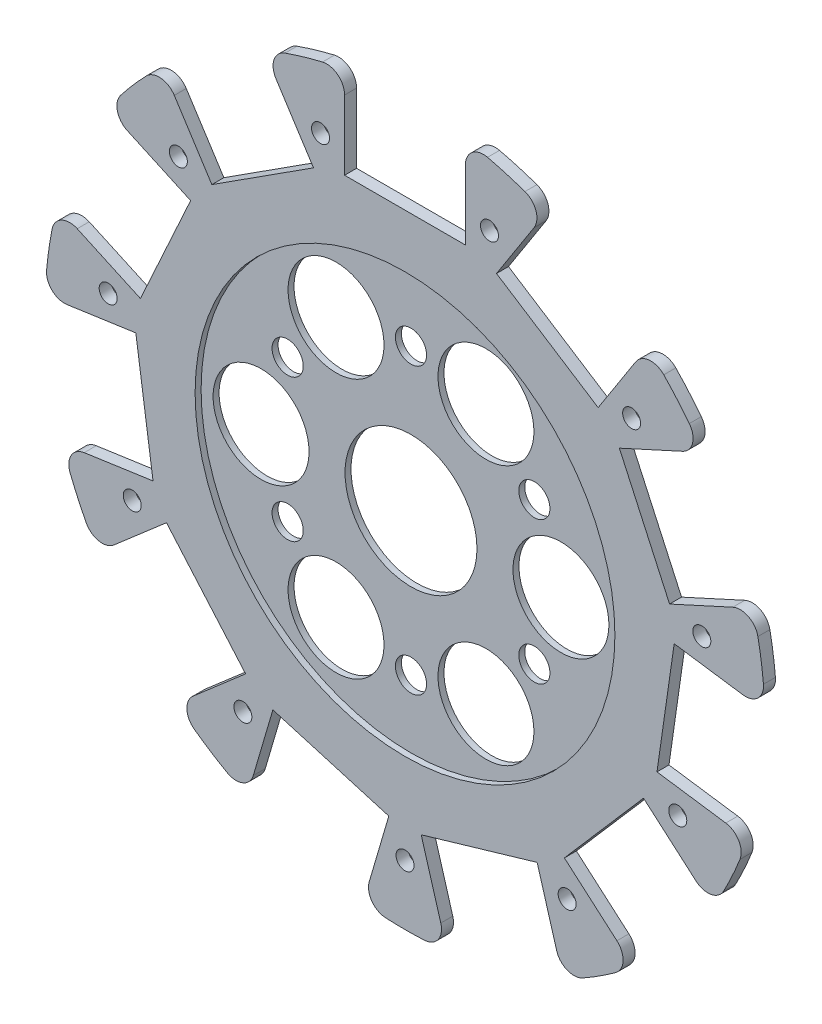
from build123d import *

# Parameters (mm, degrees)
BOSS_EXTRUDE1_DEPTH = 2
SKETCH2_R           = 35
CUT_EXTRUDE1_DEPTH  = 1
SKETCH3_R           = 11
SKETCH3_R_2         = 2.6
SKETCH3_R_3         = 8
CUT_EXTRUDE2_DEPTH  = 1
SKETCH4_R           = 1.5
CUT_EXTRUDE3_DEPTH  = 2


with BuildPart() as part:
    # Sketch1 → Boss-Extrude1 (new body)
    with BuildSketch(Plane.XY):
        with BuildLine():
            Line((21.520746486, 52.119258472), (15.256667967, 42.372162038))
            Line((15.256667967, 42.372162038), (32.20522538, 31.479985569))
            Line((32.20522538, 31.479985569), (38.4693039, 41.227082003))
            ThreePointArc((38.4693039, 41.227082003), (40.698070229, 42.590620718), (43.150594208, 41.689641633))
            ThreePointArc((43.150594208, 41.689641633), (45.344974461, 39.291644037), (47.406271028, 36.778328771))
            ThreePointArc((47.406271028, 36.778328771), (47.949048893, 34.222545257), (46.282202516, 32.210516346))
            Line((46.282202516, 32.210516346), (35.742846148, 27.397353567))
            Line((35.742846148, 27.397353567), (44.112124759, 9.071189697))
            Line((44.112124759, 9.071189697), (54.651481127, 13.884352476))
            ThreePointArc((54.651481127, 13.884352476), (57.263623361, 13.826472187), (58.839711753, 11.742585779))
            ThreePointArc((58.839711753, 11.742585779), (59.389286513, 8.538890296), (59.764558712, 5.310133889))
            ThreePointArc((59.764558712, 5.310133889), (58.83941162, 2.86662411), (56.349386262, 2.075162869))
            Line((56.349386262, 2.075162869), (44.880923224, 3.724078919))
            Line((44.880923224, 3.724078919), (42.013736207, -16.217644809))
            Line((42.013736207, -16.217644809), (53.482199245, -17.86656086))
            ThreePointArc((53.482199245, -17.86656086), (55.648380681, -19.32748357), (55.847636558, -21.93265809))
            ThreePointArc((55.847636558, -21.93265809), (54.577919721, -24.92490078), (53.148021281, -27.843990983))
            ThreePointArc((53.148021281, -27.843990983), (51.048676897, -29.399429937), (48.526038015, -28.719040157))
            Line((48.526038015, -28.719040157), (39.76962429, -21.131564473))
            Line((39.76962429, -21.131564473), (26.576283265, -36.357491677))
            Line((26.576283265, -36.357491677), (35.33269699, -43.944967362))
            ThreePointArc((35.33269699, -43.944967362), (36.365170327, -46.345099856), (35.124331356, -48.644437984))
            ThreePointArc((35.124331356, -48.644437984), (32.438449047, -50.47521197), (29.657362619, -52.157845455))
            ThreePointArc((29.657362619, -52.157845455), (27.050347952, -52.331372705), (25.296015568, -50.395150852))
            Line((25.296015568, -50.395150852), (22.031750643, -39.278085453))
            Line((22.031750643, -39.278085453), (2.701048165, -44.954091828))
            Line((2.701048165, -44.954091828), (5.96531309, -56.071157227))
            ThreePointArc((5.96531309, -56.071157227), (5.536275339, -58.648474396), (3.249299125, -59.911952524))
            ThreePointArc((3.249299125, -59.911952524), (0, -60), (-3.249299125, -59.911952524))
            ThreePointArc((-3.249299125, -59.911952524), (-5.536275339, -58.648474396), (-5.96531309, -56.071157227))
            Line((-5.96531309, -56.071157227), (-2.701048165, -44.954091828))
            Line((-2.701048165, -44.954091828), (-22.031750643, -39.278085453))
            Line((-22.031750643, -39.278085453), (-25.296015568, -50.395150852))
            ThreePointArc((-25.296015568, -50.395150852), (-27.050347952, -52.331372705), (-29.657362619, -52.157845455))
            ThreePointArc((-29.657362619, -52.157845455), (-32.438449047, -50.47521197), (-35.124331356, -48.644437984))
            ThreePointArc((-35.124331356, -48.644437984), (-36.365170327, -46.345099856), (-35.33269699, -43.944967362))
            Line((-35.33269699, -43.944967362), (-26.576283265, -36.357491677))
            Line((-26.576283265, -36.357491677), (-39.76962429, -21.131564473))
            Line((-39.76962429, -21.131564473), (-48.526038015, -28.719040157))
            ThreePointArc((-48.526038015, -28.719040157), (-51.048676897, -29.399429937), (-53.148021281, -27.843990983))
            ThreePointArc((-53.148021281, -27.843990983), (-54.577919721, -24.92490078), (-55.847636558, -21.93265809))
            ThreePointArc((-55.847636558, -21.93265809), (-55.648380681, -19.32748357), (-53.482199245, -17.86656086))
            Line((-53.482199245, -17.86656086), (-42.013736207, -16.217644809))
            Line((-42.013736207, -16.217644809), (-44.880923224, 3.724078919))
            Line((-44.880923224, 3.724078919), (-56.349386262, 2.075162869))
            ThreePointArc((-56.349386262, 2.075162869), (-58.83941162, 2.86662411), (-59.764558712, 5.310133889))
            ThreePointArc((-59.764558712, 5.310133889), (-59.389286513, 8.538890296), (-58.839711753, 11.742585779))
            ThreePointArc((-58.839711753, 11.742585779), (-57.263623361, 13.826472187), (-54.651481127, 13.884352476))
            Line((-54.651481127, 13.884352476), (-44.112124759, 9.071189697))
            Line((-44.112124759, 9.071189697), (-35.742846148, 27.397353567))
            Line((-35.742846148, 27.397353567), (-46.282202516, 32.210516346))
            ThreePointArc((-46.282202516, 32.210516346), (-47.949048893, 34.222545257), (-47.406271028, 36.778328771))
            ThreePointArc((-47.406271028, 36.778328771), (-45.344974461, 39.291644037), (-43.150594208, 41.689641633))
            ThreePointArc((-43.150594208, 41.689641633), (-40.698070229, 42.590620718), (-38.4693039, 41.227082003))
            Line((-38.4693039, 41.227082003), (-32.20522538, 31.479985569))
            Line((-32.20522538, 31.479985569), (-15.256667967, 42.372162038))
            Line((-15.256667967, 42.372162038), (-21.520746486, 52.119258472))
            ThreePointArc((-21.520746486, 52.119258472), (-21.835201934, 54.713050089), (-19.99682725, 56.569664131))
            ThreePointArc((-19.99682725, 56.569664131), (-16.90395341, 57.569578417), (-13.76146789, 58.400530832))
            ThreePointArc((-13.76146789, 58.400530832), (-11.211167359, 57.832548102), (-10.073394495, 55.480504291))
            Line((-10.073394495, 55.480504291), (-10.073394495, 43.894108449))
            Line((-10.073394495, 43.894108449), (10.073394495, 43.894108449))
            Line((10.073394495, 43.894108449), (10.073394495, 55.480504291))
            ThreePointArc((10.073394495, 55.480504291), (11.211167359, 57.832548102), (13.76146789, 58.400530832))
            ThreePointArc((13.76146789, 58.400530832), (16.90395341, 57.569578417), (19.99682725, 56.569664131))
            ThreePointArc((19.99682725, 56.569664131), (21.835201934, 54.713050089), (21.520746486, 52.119258472))
        make_face()
    extrude(amount=BOSS_EXTRUDE1_DEPTH)

    # Sketch2 → Cut-Extrude1 (cut)
    with BuildSketch(Plane.XY.offset(2)):
        Circle(SKETCH2_R)
    extrude(amount=-CUT_EXTRUDE1_DEPTH, mode=Mode.SUBTRACT)

    # Sketch3 → Cut-Extrude2 (cut)
    with BuildSketch(Plane.XY.offset(1)):
        Circle(SKETCH3_R)
        with Locations((0, 23.75)):
            Circle(SKETCH3_R_2)
        with Locations((20.56810334, 11.875)):
            Circle(SKETCH3_R_2)
        with Locations((20.56810334, -11.875)):
            Circle(SKETCH3_R_2)
        with Locations((0, -23.75)):
            Circle(SKETCH3_R_2)
        with Locations((-20.56810334, -11.875)):
            Circle(SKETCH3_R_2)
        with Locations((-20.56810334, 11.875)):
            Circle(SKETCH3_R_2)
        with Locations((-12.5, 21.650635095)):
            Circle(SKETCH3_R_3)
        with Locations((12.5, 21.650635095)):
            Circle(SKETCH3_R_3)
        with Locations((25, 0)):
            Circle(SKETCH3_R_3)
        with Locations((12.5, -21.650635095)):
            Circle(SKETCH3_R_3)
        with Locations((-12.5, -21.650635095)):
            Circle(SKETCH3_R_3)
        with Locations((-25, 0)):
            Circle(SKETCH3_R_3)
    extrude(amount=-CUT_EXTRUDE2_DEPTH, mode=Mode.SUBTRACT)

    # Sketch4 → Cut-Extrude3 (cut)
    with BuildSketch(Plane.XY.offset(2)):
        with Locations((-14.086627842, 47.974648681)):
            Circle(SKETCH4_R)
        with Locations((14.086627842, 47.974648681)):
            Circle(SKETCH4_R)
        with Locations((37.787478718, 32.743036697)):
            Circle(SKETCH4_R)
        with Locations((49.491072094, 7.115741914)):
            Circle(SKETCH4_R)
        with Locations((45.481599768, -20.77075065)):
            Circle(SKETCH4_R)
        with Locations((27.032040873, -42.062676642)):
            Circle(SKETCH4_R)
        with Locations((0, -50)):
            Circle(SKETCH4_R)
        with Locations((-27.032040873, -42.062676642)):
            Circle(SKETCH4_R)
        with Locations((-45.481599768, -20.77075065)):
            Circle(SKETCH4_R)
        with Locations((-49.491072094, 7.115741914)):
            Circle(SKETCH4_R)
        with Locations((-37.787478718, 32.743036697)):
            Circle(SKETCH4_R)
    extrude(amount=-CUT_EXTRUDE3_DEPTH, mode=Mode.SUBTRACT)


solid = part.part
